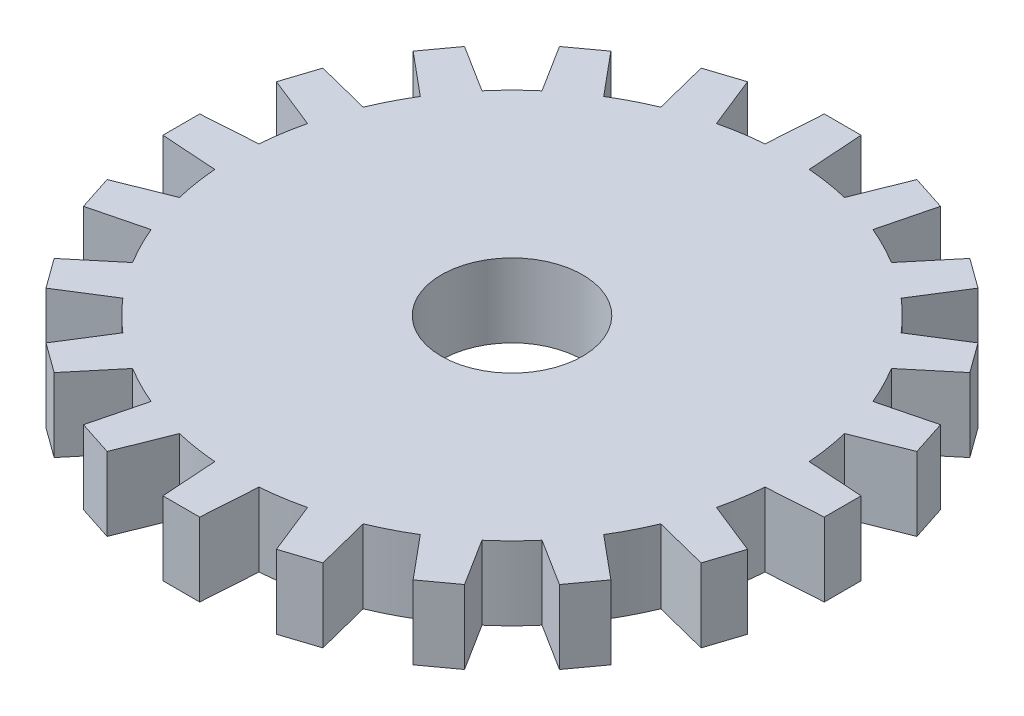
from build123d import *

# Parameters (mm, degrees)
SKETCH1_R           = 37.5
BOSS_EXTRUDE1_DEPTH = 10
SKETCH2_R           = 9.59
CUT_EXTRUDE1_DEPTH  = 10


with BuildPart() as part:
    # Sketch1 → Boss-Extrude1 (new body)
    with BuildSketch(Plane(origin=(0, 0, 0), x_dir=(1, 0, 0), z_dir=(0, 1, 0))):
        Circle(SKETCH1_R)
        with BuildLine():
            ThreePointArc((-14.404165277, 34.623258406), (-11.588137289, 35.664619361), (-8.697826179, 36.477360373))
            Line((-8.697826179, 36.477360373), (-11.506647359, 43.503989088))
            Line((-11.506647359, 43.503989088), (-16.26192994, 41.958904116))
            Line((-16.26192994, 41.958904116), (-14.404165277, 34.623258406))
        make_face()
        with BuildLine():
            ThreePointArc((-24.398350496, 28.477543663), (-22.041946961, 30.338137289), (-19.54424853, 32.004255176))
            Line((-19.54424853, 32.004255176), (-24.386943903, 37.819002725))
            Line((-24.386943903, 37.819002725), (-28.432028874, 34.880076463))
            Line((-28.432028874, 34.880076463), (-24.398350496, 28.477543663))
        make_face()
        with BuildLine():
            ThreePointArc((-32.004255176, 19.54424853), (-30.338137289, 22.041946961), (-28.477543663, 24.398350496))
            Line((-28.477543663, 24.398350496), (-34.880076463, 28.432028874))
            Line((-34.880076463, 28.432028874), (-37.819002725, 24.386943903))
            Line((-37.819002725, 24.386943903), (-32.004255176, 19.54424853))
        make_face()
        with BuildLine():
            ThreePointArc((-36.477360373, 8.697826179), (-35.664619361, 11.588137289), (-34.623258406, 14.404165277))
            Line((-34.623258406, 14.404165277), (-41.958904116, 16.26192994))
            Line((-41.958904116, 16.26192994), (-43.503989088, 11.506647359))
            Line((-43.503989088, 11.506647359), (-36.477360373, 8.697826179))
        make_face()
        with BuildLine():
            ThreePointArc((-37.379807383, -3), (-37.5, 0), (-37.379807383, 3))
            Line((-37.379807383, 3), (-44.930501889, 2.5))
            Line((-44.930501889, 2.5), (-44.930501889, -2.5))
            Line((-44.930501889, -2.5), (-37.379807383, -3))
        make_face()
        with BuildLine():
            ThreePointArc((-34.623258406, -14.404165277), (-35.664619361, -11.588137289), (-36.477360373, -8.697826179))
            Line((-36.477360373, -8.697826179), (-43.503989088, -11.506647359))
            Line((-43.503989088, -11.506647359), (-41.958904116, -16.26192994))
            Line((-41.958904116, -16.26192994), (-34.623258406, -14.404165277))
        make_face()
        with BuildLine():
            ThreePointArc((-28.477543663, -24.398350496), (-30.338137289, -22.041946961), (-32.004255176, -19.54424853))
            Line((-32.004255176, -19.54424853), (-37.819002725, -24.386943903))
            Line((-37.819002725, -24.386943903), (-34.880076463, -28.432028874))
            Line((-34.880076463, -28.432028874), (-28.477543663, -24.398350496))
        make_face()
        with BuildLine():
            ThreePointArc((-19.54424853, -32.004255176), (-22.041946961, -30.338137289), (-24.398350496, -28.477543663))
            Line((-24.398350496, -28.477543663), (-28.432028874, -34.880076463))
            Line((-28.432028874, -34.880076463), (-24.386943903, -37.819002725))
            Line((-24.386943903, -37.819002725), (-19.54424853, -32.004255176))
        make_face()
        with BuildLine():
            ThreePointArc((-8.697826179, -36.477360373), (-11.588137289, -35.664619361), (-14.404165277, -34.623258406))
            Line((-14.404165277, -34.623258406), (-16.26192994, -41.958904116))
            Line((-16.26192994, -41.958904116), (-11.506647359, -43.503989088))
            Line((-11.506647359, -43.503989088), (-8.697826179, -36.477360373))
        make_face()
        with BuildLine():
            ThreePointArc((3, -37.379807383), (0, -37.5), (-3, -37.379807383))
            Line((-3, -37.379807383), (-2.5, -44.930501889))
            Line((-2.5, -44.930501889), (2.5, -44.930501889))
            Line((2.5, -44.930501889), (3, -37.379807383))
        make_face()
        with BuildLine():
            Line((11.506647359, -43.503989088), (16.26192994, -41.958904116))
            Line((16.26192994, -41.958904116), (14.404165277, -34.623258406))
            ThreePointArc((14.404165277, -34.623258406), (11.588137289, -35.664619361), (8.697826179, -36.477360373))
            Line((8.697826179, -36.477360373), (11.506647359, -43.503989088))
        make_face()
        with BuildLine():
            Line((24.386943903, -37.819002725), (28.432028874, -34.880076463))
            Line((28.432028874, -34.880076463), (24.398350496, -28.477543663))
            ThreePointArc((24.398350496, -28.477543663), (22.041946961, -30.338137289), (19.54424853, -32.004255176))
            Line((19.54424853, -32.004255176), (24.386943903, -37.819002725))
        make_face()
        with BuildLine():
            Line((34.880076463, -28.432028874), (37.819002725, -24.386943903))
            Line((37.819002725, -24.386943903), (32.004255176, -19.54424853))
            ThreePointArc((32.004255176, -19.54424853), (30.338137289, -22.041946961), (28.477543663, -24.398350496))
            Line((28.477543663, -24.398350496), (34.880076463, -28.432028874))
        make_face()
        with BuildLine():
            Line((41.958904116, -16.26192994), (43.503989088, -11.506647359))
            Line((43.503989088, -11.506647359), (36.477360373, -8.697826179))
            ThreePointArc((36.477360373, -8.697826179), (35.664619361, -11.588137289), (34.623258406, -14.404165277))
            Line((34.623258406, -14.404165277), (41.958904116, -16.26192994))
        make_face()
        with BuildLine():
            Line((44.930501889, 2.5), (37.379807383, 3))
            ThreePointArc((37.379807383, 3), (37.469939798, 1.501203373), (37.5, 0))
            ThreePointArc((37.5, 0), (37.469939798, -1.501203373), (37.379807383, -3))
            Line((37.379807383, -3), (44.930501889, -2.5))
            Line((44.930501889, -2.5), (44.930501889, 2.5))
        make_face()
        with BuildLine():
            Line((41.958904116, 16.26192994), (34.623258406, 14.404165277))
            ThreePointArc((34.623258406, 14.404165277), (35.664619361, 11.588137289), (36.477360373, 8.697826179))
            Line((36.477360373, 8.697826179), (43.503989088, 11.506647359))
            Line((43.503989088, 11.506647359), (41.958904116, 16.26192994))
        make_face()
        with BuildLine():
            Line((34.880076463, 28.432028874), (28.477543663, 24.398350496))
            ThreePointArc((28.477543663, 24.398350496), (30.338137289, 22.041946961), (32.004255176, 19.54424853))
            Line((32.004255176, 19.54424853), (37.819002725, 24.386943903))
            Line((37.819002725, 24.386943903), (34.880076463, 28.432028874))
        make_face()
        with BuildLine():
            Line((24.386943903, 37.819002725), (19.54424853, 32.004255176))
            ThreePointArc((19.54424853, 32.004255176), (22.041946961, 30.338137289), (24.398350496, 28.477543663))
            Line((24.398350496, 28.477543663), (28.432028874, 34.880076463))
            Line((28.432028874, 34.880076463), (24.386943903, 37.819002725))
        make_face()
        with BuildLine():
            Line((11.506647359, 43.503989088), (8.697826179, 36.477360373))
            ThreePointArc((8.697826179, 36.477360373), (11.588137289, 35.664619361), (14.404165277, 34.623258406))
            Line((14.404165277, 34.623258406), (16.26192994, 41.958904116))
            Line((16.26192994, 41.958904116), (11.506647359, 43.503989088))
        make_face()
        with BuildLine():
            Line((-2.5, 44.930501889), (-3, 37.379807383))
            ThreePointArc((-3, 37.379807383), (0, 37.5), (3, 37.379807383))
            Line((3, 37.379807383), (2.5, 44.930501889))
            Line((2.5, 44.930501889), (-2.5, 44.930501889))
        make_face()
    extrude(amount=BOSS_EXTRUDE1_DEPTH)

    # Sketch2 → Cut-Extrude1 (cut)
    with BuildSketch(Plane(origin=(0, 10, 0), x_dir=(1, 0, 0), z_dir=(0, 1, 0))):
        with Locations(Location((0, 0, 0), (0, 0, 270))):
            Circle(SKETCH2_R)
    extrude(amount=-CUT_EXTRUDE1_DEPTH, mode=Mode.SUBTRACT)


solid = part.part
